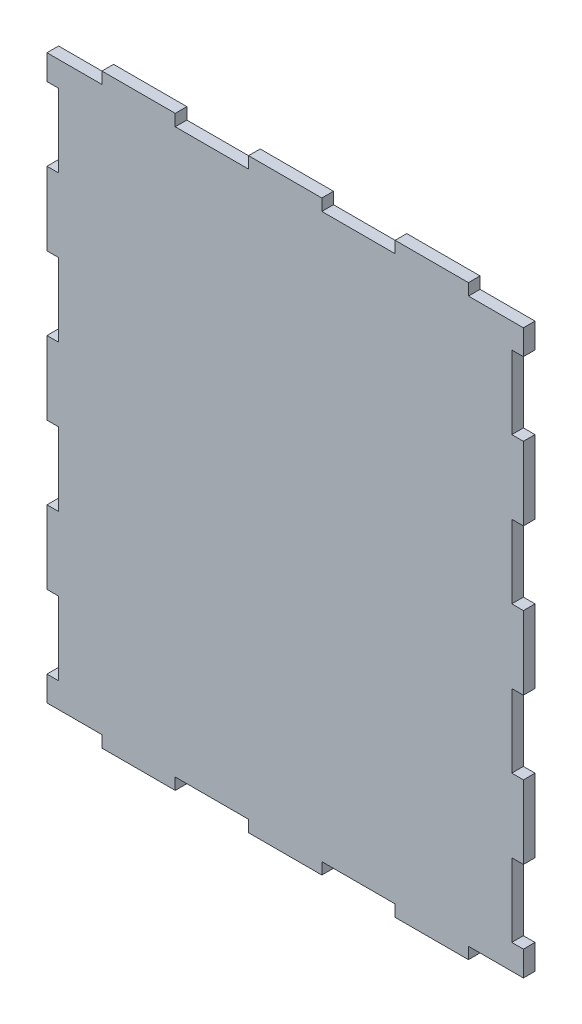
from build123d import *

# Parameters (mm, degrees)
SKETCH1_W           = 130
SKETCH1_H           = 160
BOSS_EXTRUDE1_DEPTH = 3.175
SKETCH2_W           = 3.175
SKETCH2_H           = 20
SKETCH2_W_2         = 15
SKETCH2_H_2         = 3.175
SKETCH2_W_3         = 20
CUT_EXTRUDE1_DEPTH  = 3.175


with BuildPart() as part:
    # Sketch1 → Boss-Extrude1 (new body)
    with BuildSketch(Plane.XY):
        with Locations((-10.981871877, 76.825)):
            Rectangle(SKETCH1_W, SKETCH1_H)
    extrude(amount=-BOSS_EXTRUDE1_DEPTH)

    # Sketch2 → Cut-Extrude1 (cut)
    with BuildSketch(Plane.XY):
        with Locations((-74.394371877, 56.825)):
            Rectangle(SKETCH2_W, SKETCH2_H)
        with Locations((-74.394371877, 96.825)):
            Rectangle(SKETCH2_W, SKETCH2_H)
        with Locations((-74.394371877, 136.825)):
            Rectangle(SKETCH2_W, SKETCH2_H)
        with Locations((-68.481871877, 155.2375)):
            Rectangle(SKETCH2_W_2, SKETCH2_H_2)
        with Locations((-30.981871877, 155.2375)):
            Rectangle(SKETCH2_W_3, SKETCH2_H_2)
        with Locations((9.018128123, 155.2375)):
            Rectangle(SKETCH2_W_3, SKETCH2_H_2)
        with Locations((46.518128123, 155.2375)):
            Rectangle(SKETCH2_W_2, SKETCH2_H_2)
        with Locations((52.430628123, 136.825)):
            Rectangle(SKETCH2_W, SKETCH2_H)
        with Locations((52.430628123, 96.825)):
            Rectangle(SKETCH2_W, SKETCH2_H)
        with Locations((52.430628123, 56.825)):
            Rectangle(SKETCH2_W, SKETCH2_H)
        with Locations((52.430628123, 16.825)):
            Rectangle(SKETCH2_W, SKETCH2_H)
        with Locations((46.518128123, -1.5875)):
            Rectangle(SKETCH2_W_2, SKETCH2_H_2)
        with Locations((9.018128123, -1.5875)):
            Rectangle(SKETCH2_W_3, SKETCH2_H_2)
        with Locations((-30.981871877, -1.5875)):
            Rectangle(SKETCH2_W_3, SKETCH2_H_2)
        with Locations((-74.394371877, 16.825)):
            Rectangle(SKETCH2_W, SKETCH2_H)
        with Locations((-68.481871877, -1.5875)):
            Rectangle(SKETCH2_W_2, SKETCH2_H_2)
    extrude(amount=-CUT_EXTRUDE1_DEPTH, mode=Mode.SUBTRACT)


solid = part.part
